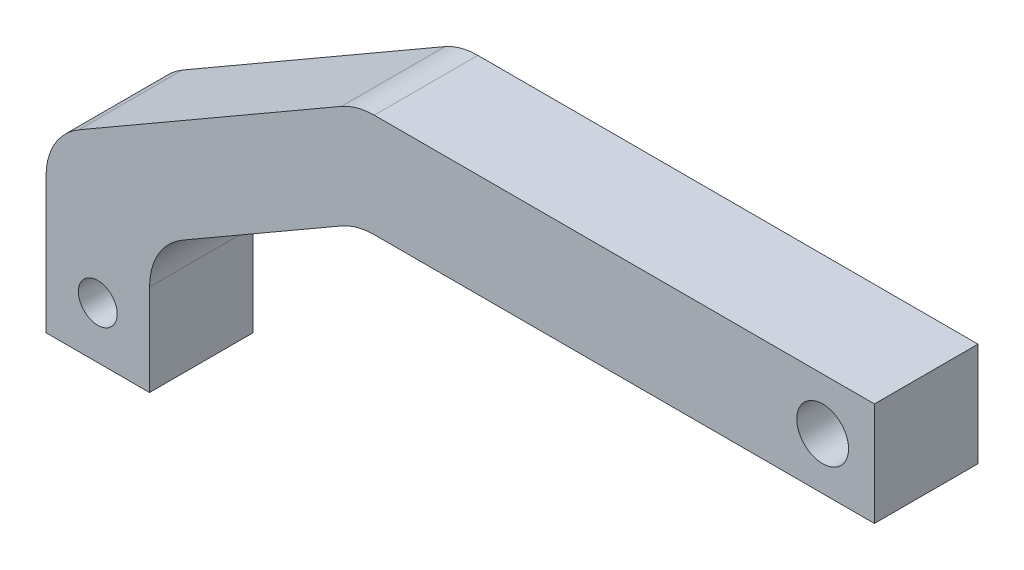
from build123d import *

# Parameters (mm, degrees)
BOSS_EXTRUDE1_DEPTH = 20
FILLET2_R           = 12.7
SKETCH2_R           = 5
SKETCH2_R_2         = 3.75
CUT_EXTRUDE1_DEPTH  = 166.94214143


with BuildPart() as part:
    # Sketch1 → Boss-Extrude1 (new body)
    with BuildSketch(Plane.XY):
        Polygon((10, 0), (10, 25), (50, 48.094010768), (150, 48.094010768), (150, 68.094010768), (50, 68.094010768), (-10, 33.452994616), (-10, 0), align=None)
    extrude(amount=BOSS_EXTRUDE1_DEPTH)

    # Fillet2
    fillet2_edges = [part.edges().sort_by_distance(p)[0] for p in [
        (-10, 33.452994616, 10),
        (50, 68.094010768, 10),
        (50, 48.094010768, 10),
        (10, 25, 10),
    ]]
    fillet(fillet2_edges, radius=FILLET2_R)

    # Sketch2 → Cut-Extrude1 (cut, through all)
    with BuildSketch(Plane.XY.offset(20)):
        with Locations((140, 58.094010768)):
            Circle(SKETCH2_R)
        with Locations((0, 10)):
            Circle(SKETCH2_R_2)
    extrude(amount=-CUT_EXTRUDE1_DEPTH, mode=Mode.SUBTRACT)


solid = part.part
